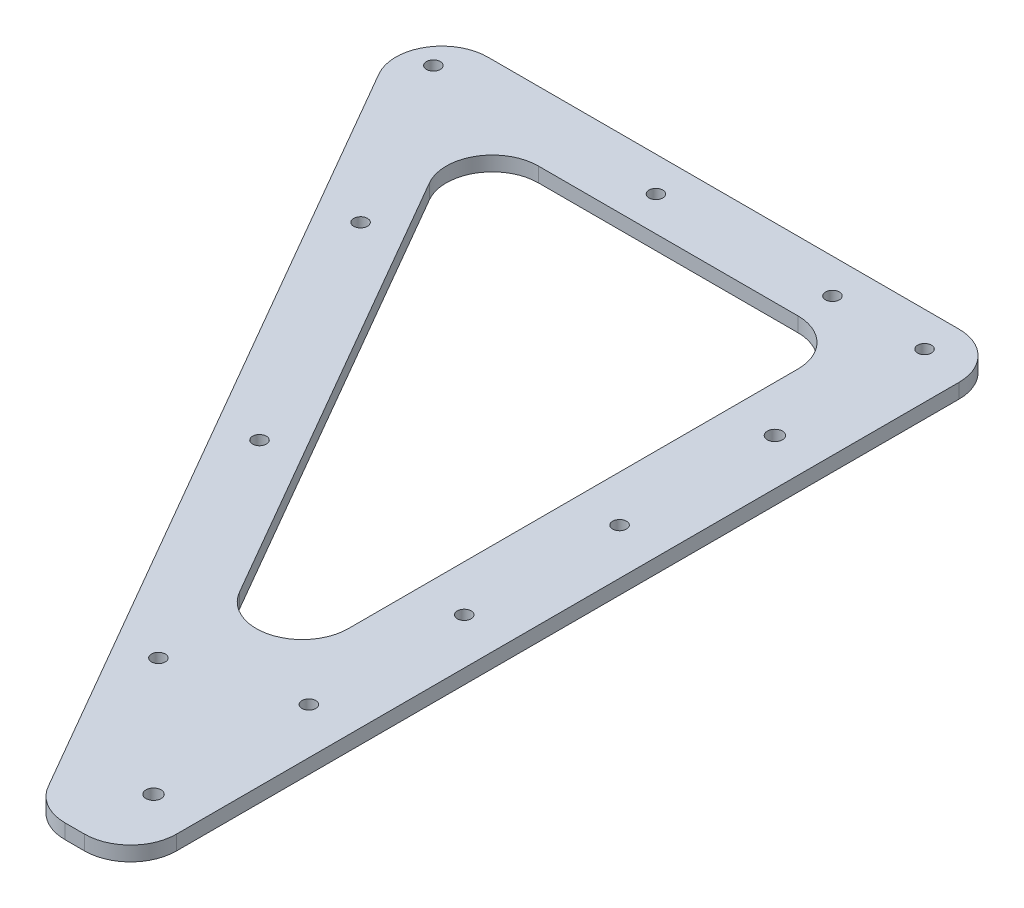
from build123d import *

# Parameters (mm, degrees)
SKETCH1_R           = 1.5
SKETCH1_R_2         = 1.65
BOSS_EXTRUDE1_DEPTH = 3.175
FILLET1_R           = 10


with BuildPart() as part:
    # Sketch1 → Boss-Extrude1 (new body)
    with BuildSketch(Plane(origin=(0, 0, 0), x_dir=(1, 0, 0), z_dir=(0, 1, 0))):
        Polygon((-20, -190), (0, -190), (0, 0), (-129.696551146, 0), align=None)
        with Locations(Location((-65.10548978, -96.875, 0), (0, 0, 270))):
            Circle(SKETCH1_R, mode=Mode.SUBTRACT)
        with Locations(Location((-10, -175, 0), (0, 0, 270))):
            Circle(SKETCH1_R_2, mode=Mode.SUBTRACT)
        with Locations(Location((-35.10548978, -148.836524227, 0), (0, 0, 270))):
            Circle(SKETCH1_R, mode=Mode.SUBTRACT)
        with BuildLine():
            ThreePointArc((-10, -139.75), (-8.5, -141.25), (-10, -142.75))
            ThreePointArc((-10, -142.75), (-11.5, -141.25), (-10, -139.75))
        make_face(mode=Mode.SUBTRACT)
        with BuildLine():
            ThreePointArc((-10, -106), (-8.5, -107.5), (-10, -109))
            ThreePointArc((-10, -109), (-11.5, -107.5), (-10, -106))
        make_face(mode=Mode.SUBTRACT)
        with Locations(Location((-95.10548978, -44.913475773, 0), (0, 0, 270))):
            Circle(SKETCH1_R, mode=Mode.SUBTRACT)
        with Locations(Location((-116.706170089, -7.5, 0), (0, 0, 270))):
            Circle(SKETCH1_R, mode=Mode.SUBTRACT)
        with Locations(Location((-68.353085045, -7.5, 0), (0, 0, 270))):
            Circle(SKETCH1_R, mode=Mode.SUBTRACT)
        Polygon((-20, -15), (-20, -160), (-103.715789032, -15), align=None, mode=Mode.SUBTRACT)
        with BuildLine():
            ThreePointArc((-10, -72.25), (-8.5, -73.75), (-10, -75.25))
            ThreePointArc((-10, -75.25), (-11.5, -73.75), (-10, -72.25))
        make_face(mode=Mode.SUBTRACT)
        with Locations(Location((-10, -40, 0), (0, 0, 270))):
            Circle(SKETCH1_R_2, mode=Mode.SUBTRACT)
        with Locations(Location((-30, -7.5, 0), (0, 0, 270))):
            Circle(SKETCH1_R, mode=Mode.SUBTRACT)
        with Locations(Location((-10, -7.5, 0), (0, 0, 270))):
            Circle(SKETCH1_R, mode=Mode.SUBTRACT)
    extrude(amount=BOSS_EXTRUDE1_DEPTH)

    # Fillet1
    fillet1_edges = [part.edges().sort_by_distance(p)[0] for p in [
        (-20, 1.5875, 15),
        (-103.715789032, 1.5875, 15),
        (-20, 1.5875, 160),
        (-129.696551146, 1.5875, 0),
        (0, 1.5875, 0),
        (0, 1.5875, 190),
        (-20, 1.5875, 190),
    ]]
    fillet(fillet1_edges, radius=FILLET1_R)


solid = part.part
